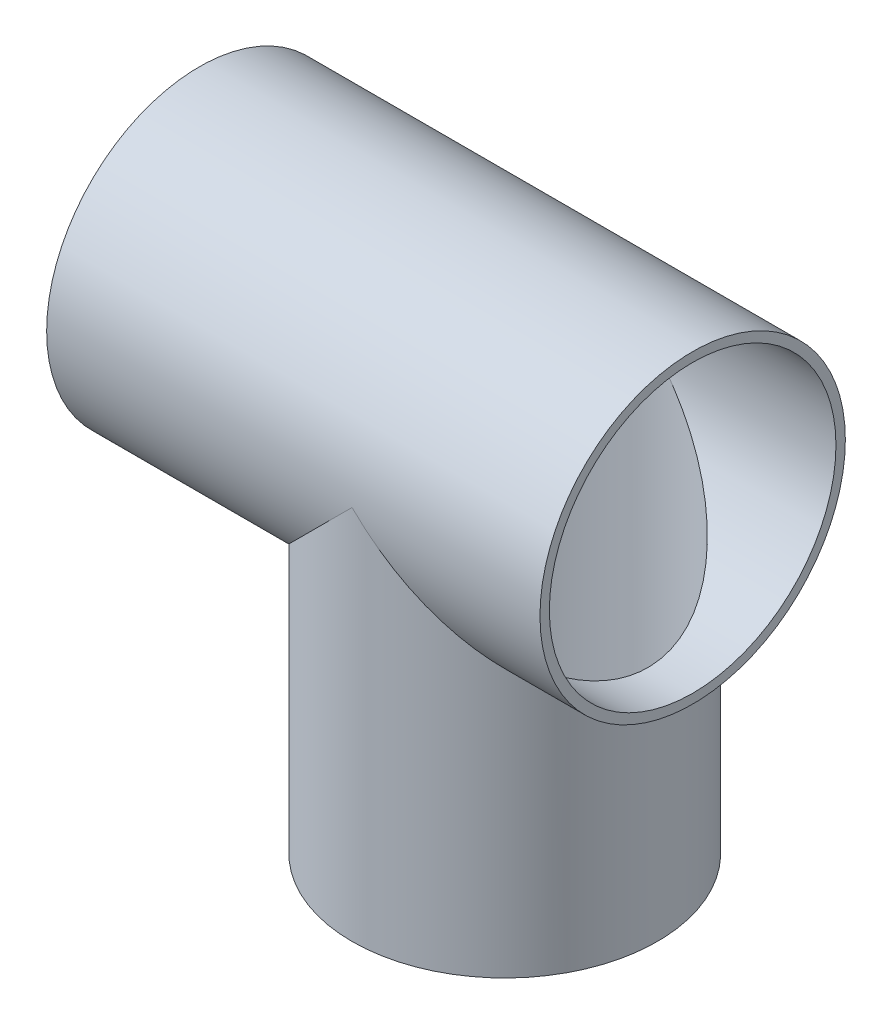
from build123d import *
from build123d.topology import SkipClean

# Parameters (mm, degrees)
BOSS_EXTRUDE1_DEPTH      = 40
BOSS_EXTRUDE1_DEPTH_BACK = 40
SKETCH1_R                = 32.5
SKETCH1_R_2              = 30.5
SKETCH2_R                = 32.5
SKETCH2_R_2              = 30.5
BOSS_EXTRUDE2_DEPTH      = 80
SKETCH3_R                = 30.5
CUT_EXTRUDE1_DEPTH       = 80
CUT_EXTRUDE2_START       = -79
SKETCH4_R                = 30.5
CUT_EXTRUDE2_DEPTH       = 79
SKETCH5_R                = 32.5
SKETCH5_R_2              = 30.5
BOSS_EXTRUDE3_DEPTH      = 25


with BuildPart() as part:
    # Sketch1 → Boss-Extrude1 (new, two sides: drawn at the far end of the back side and taken through both)
    with BuildSketch(Plane(origin=(0, 0, 0), x_dir=(0, 0, -1), z_dir=(1, 0, 0)).offset(-BOSS_EXTRUDE1_DEPTH_BACK)):
        Circle(SKETCH1_R)
        Circle(SKETCH1_R_2, mode=Mode.SUBTRACT)
    extrude(amount=BOSS_EXTRUDE1_DEPTH + BOSS_EXTRUDE1_DEPTH_BACK)

    # Sketch2 → Boss-Extrude2 (add)
    with BuildSketch(Plane(origin=(0, 0, 0), x_dir=(1, 0, 0), z_dir=(0, 1, 0))):
        Circle(SKETCH2_R)
        Circle(SKETCH2_R_2, mode=Mode.SUBTRACT)
    extrude(amount=-BOSS_EXTRUDE2_DEPTH)

    # Sketch3 → Cut-Extrude1 (cut)
    with BuildSketch(Plane(origin=(40, 0, 0), x_dir=(0, 0, -1), z_dir=(1, 0, 0))):
        Circle(SKETCH3_R)
    extrude(amount=-CUT_EXTRUDE1_DEPTH, mode=Mode.SUBTRACT)

    # Sketch4 → Cut-Extrude2 (cut)
    with SkipClean():  # the faces are left unmerged after this step: merging them gives an invalid solid
        with BuildSketch(Plane.XZ.offset(80).offset(CUT_EXTRUDE2_START)):
            Circle(SKETCH4_R)
        extrude(amount=CUT_EXTRUDE2_DEPTH, mode=Mode.SUBTRACT)

    # Sketch5 → Boss-Extrude3 (add)
    with BuildSketch(Plane.ZY.offset(40)):
        Circle(SKETCH5_R)
        Circle(SKETCH5_R_2, mode=Mode.SUBTRACT)
    extrude(amount=BOSS_EXTRUDE3_DEPTH)


solid = part.part
